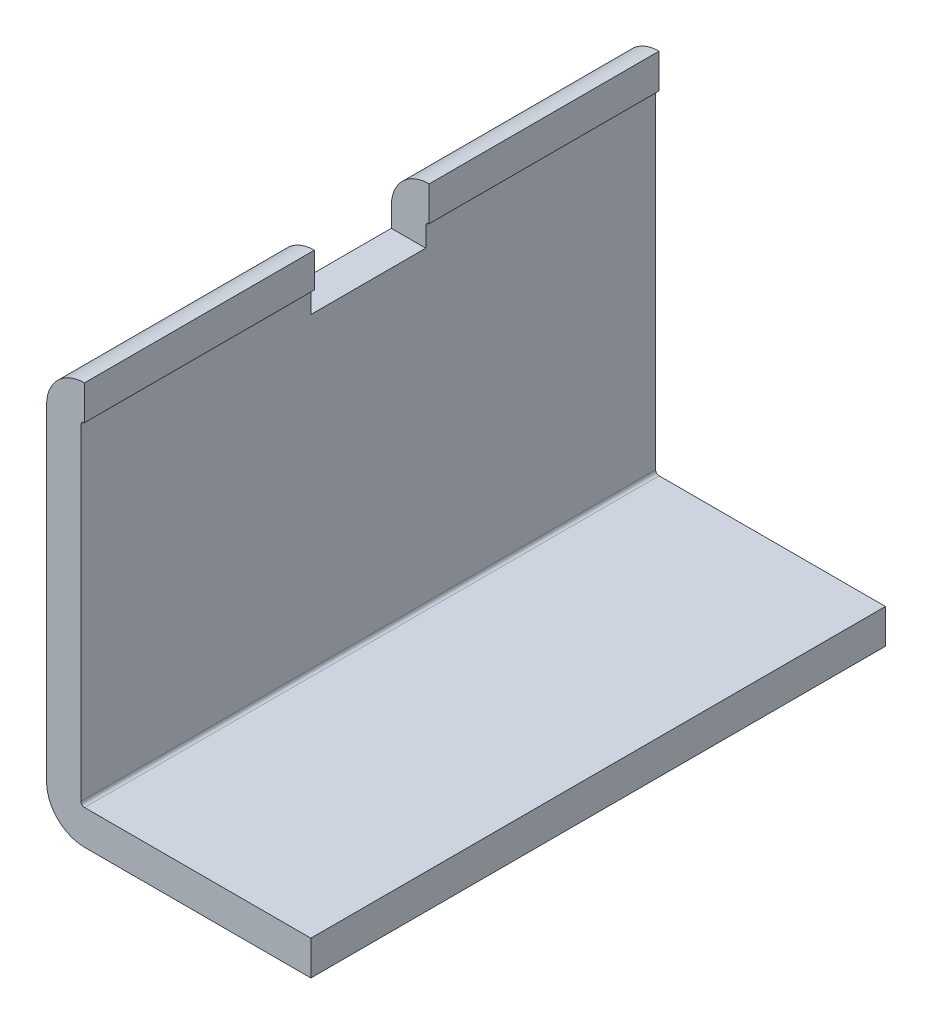
from build123d import *

# Parameters (mm, degrees)
EXTRUDE_1_DEPTH          = 5
CUT_EXTRUDE_1_DEPTH      = 7.239374969
CUT_EXTRUDE_1_DEPTH_BACK = 7.239374969
SKETCH_2_W               = 1
SKETCH_2_H               = 0.5


with BuildPart() as part:
    # 草图1 → 拉伸-薄壁1 (new body)
    with BuildSketch(Plane.XY):
        with BuildLine():
            ThreePointArc((0.03, 0.03), (0.008786797, 0.021213203), (0, 0))
            Line((0, 0), (0, -2.84))
            ThreePointArc((0, -2.84), (0.008786797, -2.861213203), (0.03, -2.87))
            Line((0.03, -2.87), (2, -2.87))
            Line((2, -2.87), (2, -3.17))
            Line((2, -3.17), (0.03, -3.17))
            ThreePointArc((0.03, -3.17), (-0.203345238, -3.073345238), (-0.3, -2.84))
            Line((-0.3, -2.84), (-0.3, 0))
            ThreePointArc((-0.3, 0), (-0.203345238, 0.233345238), (0.03, 0.33))
            Line((0.03, 0.33), (0.03, 0.03))
        make_face()
    extrude(amount=EXTRUDE_1_DEPTH)

    # 草图2 → 切除-拉伸1 (cut, two sides: drawn at the far end of the back side and taken through both)
    with BuildSketch(Plane(origin=(0.03, 0, 0), x_dir=(0, 0, -1), z_dir=(1, 0, 0)).offset(-CUT_EXTRUDE_1_DEPTH_BACK)):
        with Locations((-2.5, 0.08)):
            Rectangle(SKETCH_2_W, SKETCH_2_H)
    extrude(amount=CUT_EXTRUDE_1_DEPTH + CUT_EXTRUDE_1_DEPTH_BACK, mode=Mode.SUBTRACT)


solid = part.part
